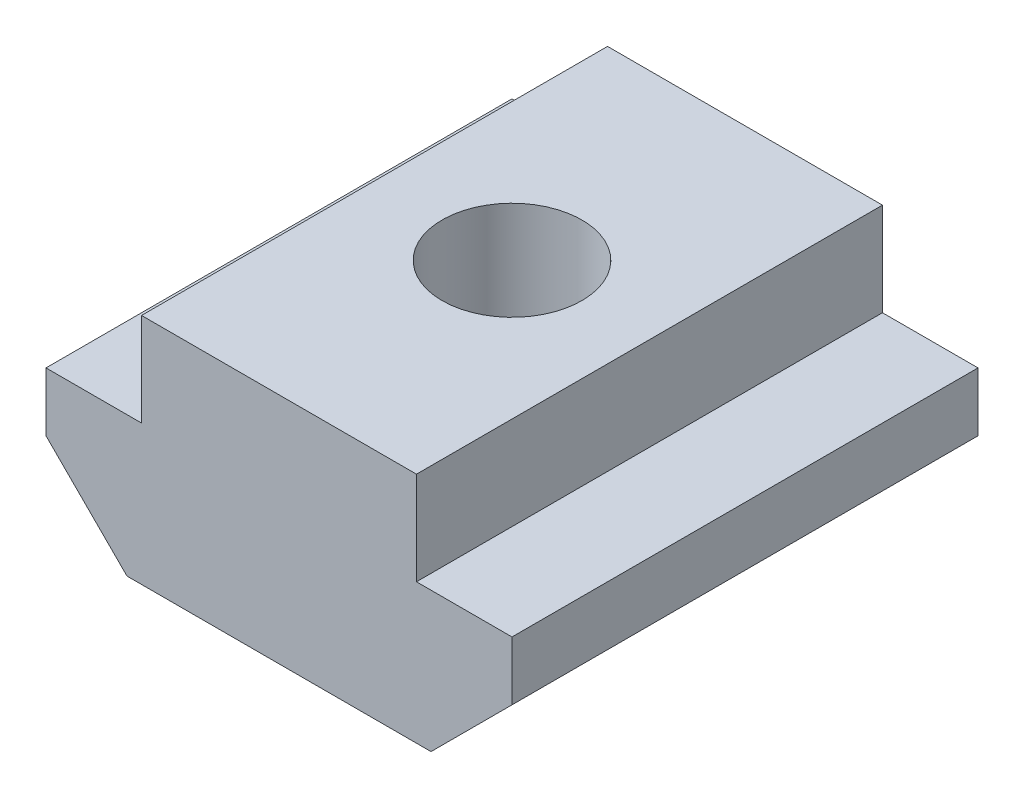
from build123d import *

# Parameters (mm, degrees)
BOSS_EXTRU_1_DEPTH      = 10
ENL_V_MAT_EXTRU_1_REACH = 18.58
ESQUISSE2_R             = 1.5


with BuildPart() as part:
    # Esquisse1 → Boss.-Extru.1 (new body)
    with BuildSketch(Plane.XY):
        Polygon((-10.506087259, -2.086075409), (-3.981368971, -2.086075409), (-2.243728115, -0.348434553), (-2.243728115, 0.913924591), (-4.293728115, 0.913924591), (-4.293728115, 2.913924591), (-10.193728115, 2.913924591), (-10.193728115, 0.913924591), (-12.243728115, 0.913924591), (-12.243728115, -0.348434553), align=None)
    extrude(amount=BOSS_EXTRU_1_DEPTH)

    # Esquisse2 → Enlèv. mat.-Extru.1 (cut, up to next)
    with BuildSketch(Plane(origin=(0, 2.913924591, 0), x_dir=(1, 0, 0), z_dir=(0, 1, 0)), mode=Mode.PRIVATE) as enl_v_mat_extru_1_sk1:
        with Locations(Location((-7.243728115, -5, 0), (0, 0, 270))):
            Circle(ESQUISSE2_R)
    enl_v_mat_extru_1_tool1 = extrude(enl_v_mat_extru_1_sk1.sketch, amount=-ENL_V_MAT_EXTRU_1_REACH, mode=Mode.PRIVATE) & part.part
    add(enl_v_mat_extru_1_tool1.solids().sort_by_distance((-7.243728, 2.913925, 5))[0], mode=Mode.SUBTRACT)


solid = part.part
